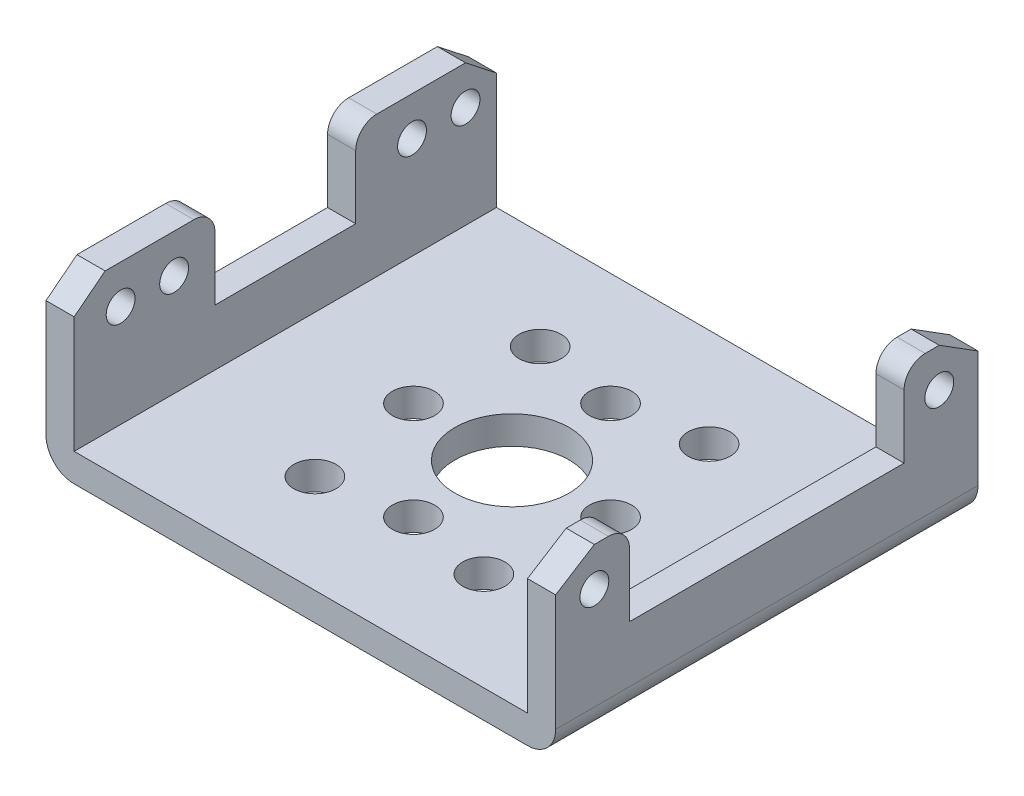
from build123d import *

# Parameters (mm, degrees)
EXTRUDE_1_DEPTH     = 30
SKETCH_2_R          = 1.025
CUT_EXTRUDE_1_DEPTH = 4
SKETCH_3_R          = 1.025
CUT_EXTRUDE_2_DEPTH = 4
SKETCH_4_R          = 4.05
SKETCH_4_R_2        = 1.5
CUT_EXTRUDE_3_DEPTH = 10


with BuildPart() as part:
    # 草图1 → 凸台-拉伸1 (new body)
    with BuildSketch(Plane.XY):
        with BuildLine():
            Line((-16.1, 0), (16.1, 0))
            Line((16.1, 0), (16.1, 10))
            Line((16.1, 10), (18.1, 10))
            Line((18.1, 10), (18.1, 0))
            ThreePointArc((18.1, 0), (17.514213562, -1.414213562), (16.1, -2))
            Line((16.1, -2), (-16.1, -2))
            ThreePointArc((-16.1, -2), (-17.514213562, -1.414213562), (-18.1, 0))
            Line((-18.1, 0), (-18.1, 10))
            Line((-18.1, 10), (-16.1, 10))
            Line((-16.1, 10), (-16.1, 0))
        make_face()
    extrude(amount=EXTRUDE_1_DEPTH)

    # 草图2 → 切除-拉伸1 (cut)
    with BuildSketch(Plane(origin=(18.1, 0, 0), x_dir=(0, 0, -1), z_dir=(1, 0, 0))):
        Polygon((-30, 8.275), (-27.25, 10), (-30, 10), align=None)
        with BuildLine():
            ThreePointArc((-5.25, 8.5), (-4.810660172, 9.560660172), (-3.75, 10))
            Line((-3.75, 10), (-26.25, 10))
            ThreePointArc((-26.25, 10), (-25.189339828, 9.560660172), (-24.75, 8.5))
            Line((-24.75, 8.5), (-24.75, 4))
            Line((-24.75, 4), (-5.25, 4))
            Line((-5.25, 4), (-5.25, 8.5))
        make_face()
        with Locations((-27.25, 7.25)):
            Circle(SKETCH_2_R)
        with Locations((-2.75, 7.25)):
            Circle(SKETCH_2_R)
        Polygon((0, 10), (-2.75, 10), (0, 8.275), align=None)
    extrude(amount=-CUT_EXTRUDE_1_DEPTH, mode=Mode.SUBTRACT)

    # 草图3 → 切除-拉伸2 (cut)
    with BuildSketch(Plane.ZY.offset(18.1)):
        Polygon((0, 8.275), (2.2, 10), (0, 10), align=None)
        with Locations((2.2, 7.25)):
            Circle(SKETCH_3_R)
        with Locations((6, 7.25)):
            Circle(SKETCH_3_R)
        with BuildLine():
            Line((10, 8.5), (10, 4))
            Line((10, 4), (20, 4))
            Line((20, 4), (20, 8.5))
            ThreePointArc((20, 8.5), (20.439339828, 9.560660172), (21.5, 10))
            Line((21.5, 10), (8.5, 10))
            ThreePointArc((8.5, 10), (9.560660172, 9.560660172), (10, 8.5))
        make_face()
        with Locations((22.9, 7.25)):
            Circle(SKETCH_3_R)
        with Locations((26.7, 7.25)):
            Circle(SKETCH_3_R)
        Polygon((30, 10), (27.8, 10), (30, 8.275), align=None)
    extrude(amount=-CUT_EXTRUDE_2_DEPTH, mode=Mode.SUBTRACT)

    # 草图4 → 切除-拉伸3 (cut)
    with BuildSketch(Plane.XZ.offset(2)):
        with Locations(Location((0, 15, 0), (0, 0, 270))):
            Circle(SKETCH_4_R)
        with Locations(Location((7, 15, 0), (0, 0, 270))):
            Circle(SKETCH_4_R_2)
        with Locations(Location((0, 8, 0), (0, 0, 270))):
            Circle(SKETCH_4_R_2)
        with Locations(Location((-7, 15, 0), (0, 0, 270))):
            Circle(SKETCH_4_R_2)
        with Locations(Location((0, 22, 0), (0, 0, 270))):
            Circle(SKETCH_4_R_2)
        with Locations(Location((-6, 23.000374583, 0), (0, 0, 270))):
            Circle(SKETCH_4_R_2)
        with Locations(Location((6, 23.000374583, 0), (0, 0, 270))):
            Circle(SKETCH_4_R_2)
        with Locations(Location((-6, 7.000374583, 0), (0, 0, 270))):
            Circle(SKETCH_4_R_2)
        with Locations(Location((6, 7.000374583, 0), (0, 0, 270))):
            Circle(SKETCH_4_R_2)
    extrude(amount=-CUT_EXTRUDE_3_DEPTH, mode=Mode.SUBTRACT)


solid = part.part
